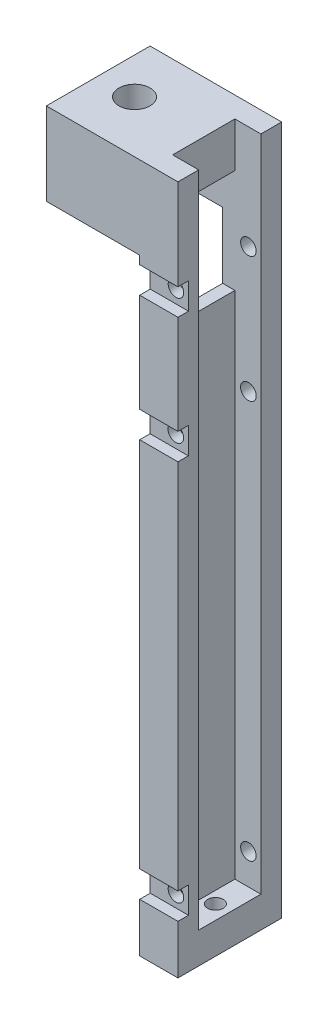
from build123d import *

# Parameters (mm, degrees)
BOSS_EXTRUDE2_DEPTH = 10
SKETCH2_W           = 6
SKETCH2_H           = 21.5
CUT_EXTRUDE1_DEPTH  = 2
SKETCH18_W          = 10
SKETCH18_H          = 4
CUT_EXTRUDE6_DEPTH  = 2.32
BOSS_EXTRUDE4_DEPTH = 35.965
SKETCH20_W          = 10
SKETCH20_H          = 4.318
BOSS_EXTRUDE5_DEPTH = 9
SKETCH21_W          = 2
SKETCH21_H          = 57.465
BOSS_EXTRUDE6_DEPTH = 0.889
BOSS_EXTRUDE7_DEPTH = 9.02
CUT_EXTRUDE7_DEPTH  = 1.016
SKETCH24_W          = 4.069
SKETCH24_H          = 2.54
CUT_EXTRUDE8_DEPTH  = 1
SKETCH30_R          = 0.75565
CUT_EXTRUDE14_DEPTH = 95.738007626
SKETCH34_R          = 1.5
CUT_EXTRUDE18_DEPTH = 10
SKETCH35_R          = 0.75
CUT_EXTRUDE19_DEPTH = 60.59814159
SKETCH36_W          = 6
SKETCH36_H          = 10
CUT_EXTRUDE20_DEPTH = 10
SKETCH37_W          = 9
SKETCH37_H          = 2
BOSS_EXTRUDE8_DEPTH = 3.65
SKETCH38_W          = 4.069
SKETCH38_H          = 10
BOSS_EXTRUDE9_DEPTH = 3
SKETCH39_R          = 0.75
CUT_EXTRUDE21_DEPTH = 3
SKETCH40_W          = 0.381
SKETCH40_H          = 10
CUT_EXTRUDE22_DEPTH = 69.478136839


with BuildPart() as part:
    # Sketch1 → Boss-Extrude2 (new body)
    with BuildSketch(Plane.XY):
        Polygon((-4, 0), (-0.82, 0), (-0.82, 21.5), (-6.32, 21.5), (-6.32, 17.5), (-4, 17.5), align=None)
    extrude(amount=BOSS_EXTRUDE2_DEPTH)

    # Sketch2 → Cut-Extrude1 (cut)
    with BuildSketch(Plane(origin=(-0.82, 0, 0), x_dir=(0, 0, -1), z_dir=(1, 0, 0))):
        with Locations((-5, 10.75)):
            Rectangle(SKETCH2_W, SKETCH2_H)
    extrude(amount=-CUT_EXTRUDE1_DEPTH, mode=Mode.SUBTRACT)

    # Sketch18 → Cut-Extrude6 (cut)
    with BuildSketch(Plane.ZY.offset(6.32)):
        with Locations((5, 19.5)):
            Rectangle(SKETCH18_W, SKETCH18_H)
    extrude(amount=-CUT_EXTRUDE6_DEPTH, mode=Mode.SUBTRACT)

    # Sketch19 → Boss-Extrude4 (add)
    with BuildSketch(Plane(origin=(0, 21.5, 0), x_dir=(1, 0, 0), z_dir=(0, 1, 0))):
        Polygon((-0.82, -10), (-4, -10), (-4, 0), (-0.82, 0), (-0.82, -2), (-2.82, -2), (-2.82, -8), (-0.82, -8), align=None)
    extrude(amount=BOSS_EXTRUDE4_DEPTH)

    # Sketch20 → Boss-Extrude5 (add)
    with BuildSketch(Plane.ZY.offset(4)):
        with Locations((5, 55.306)):
            Rectangle(SKETCH20_W, SKETCH20_H)
    extrude(amount=BOSS_EXTRUDE5_DEPTH)

    # Sketch21 → Boss-Extrude6 (add)
    with BuildSketch(Plane(origin=(-0.82, 0, 0), x_dir=(0, 0, -1), z_dir=(1, 0, 0))):
        with Locations((-9, 28.7325)):
            Rectangle(SKETCH21_W, SKETCH21_H)
        with Locations((-1, 28.7325)):
            Rectangle(SKETCH21_W, SKETCH21_H)
    extrude(amount=BOSS_EXTRUDE6_DEPTH)

    # Sketch22 → Boss-Extrude7 (add)
    with BuildSketch(Plane.XZ):
        Polygon((-4, 10), (0.069, 10), (0.069, 8), (-2.82, 8), (-2.82, 2), (0.069, 2), (0.069, 0), (-4, 0), align=None)
    extrude(amount=BOSS_EXTRUDE7_DEPTH)

    # Sketch23 → Cut-Extrude7 (cut)
    with BuildSketch(Plane.XY.offset(10)):
        Polygon((0.069, -3.02), (0.069, -4.29), (-4, -4.29), (-4, -1.75), (0.069, -1.75), align=None)
        Polygon((-4, 47.426731456), (-4, 48.696731456), (0.069, 48.696731456), (0.069, 46.156731456), (-4, 46.156731456), align=None)
    extrude(amount=-CUT_EXTRUDE7_DEPTH, mode=Mode.SUBTRACT)

    # Sketch24 → Cut-Extrude8 (cut)
    with BuildSketch(Plane.XY.offset(10)):
        with Locations((-1.9655, 35.355048592)):
            Rectangle(SKETCH24_W, SKETCH24_H)
    extrude(amount=-CUT_EXTRUDE8_DEPTH, mode=Mode.SUBTRACT)

    # Sketch30 → Cut-Extrude14 (cut, through all)
    with BuildSketch(Plane(origin=(35.063086629, -23.678267082, 9), x_dir=(1, 0, 0), z_dir=(0, 0, 1))):
        with Locations((-36.581586629, 59.033315674)):
            Circle(SKETCH30_R)
    extrude(amount=-CUT_EXTRUDE14_DEPTH, mode=Mode.SUBTRACT)

    # Sketch34 → Cut-Extrude18 (cut)
    with BuildSketch(Plane(origin=(0, 57.465, 0), x_dir=(1, 0, 0), z_dir=(0, 1, 0))):
        with Locations(Location((-9.5, -5, 0), (0, 0, 270))):
            Circle(SKETCH34_R)
    extrude(amount=-CUT_EXTRUDE18_DEPTH, mode=Mode.SUBTRACT)

    # Sketch35 → Cut-Extrude19 (cut, through all)
    with BuildSketch(Plane.XY.offset(8.984)):
        with Locations((-1.5185, 47.456731456)):
            Circle(SKETCH35_R)
        with Locations((-1.5185, -3.05)):
            Circle(SKETCH35_R)
    extrude(amount=-CUT_EXTRUDE19_DEPTH, mode=Mode.SUBTRACT)

    # Sketch36 → Cut-Extrude20 (cut)
    with BuildSketch(Plane(origin=(-2.82, 0, 0), x_dir=(0, 0, -1), z_dir=(1, 0, 0))):
        with Locations((-5, 48.147)):
            Rectangle(SKETCH36_W, SKETCH36_H)
    extrude(amount=-CUT_EXTRUDE20_DEPTH, mode=Mode.SUBTRACT)

    # Sketch37 → Boss-Extrude8 (add)
    with BuildSketch(Plane.XZ.offset(-53.147)):
        with Locations((-8.5, 9)):
            Rectangle(SKETCH37_W, SKETCH37_H)
        with Locations((-8.5, 1)):
            Rectangle(SKETCH37_W, SKETCH37_H)
    extrude(amount=BOSS_EXTRUDE8_DEPTH)

    # Sketch38 → Boss-Extrude9 (add)
    with BuildSketch(Plane.XZ.offset(9.02)):
        with Locations((-1.9655, 5)):
            Rectangle(SKETCH38_W, SKETCH38_H)
    extrude(amount=-BOSS_EXTRUDE9_DEPTH)

    # Sketch39 → Cut-Extrude21 (cut)
    with BuildSketch(Plane.XZ.offset(9.02)):
        with Locations(Location((-1.7, 5, 0), (0, 0, 270))):
            Circle(SKETCH39_R)
    extrude(amount=-CUT_EXTRUDE21_DEPTH, mode=Mode.SUBTRACT)

    # Sketch40 → Cut-Extrude22 (cut, through all)
    with BuildSketch(Plane(origin=(0, 57.465, 0), x_dir=(1, 0, 0), z_dir=(0, 1, 0))):
        with Locations((-0.1215, -5)):
            Rectangle(SKETCH40_W, SKETCH40_H)
    extrude(amount=-CUT_EXTRUDE22_DEPTH, mode=Mode.SUBTRACT)


solid = part.part
